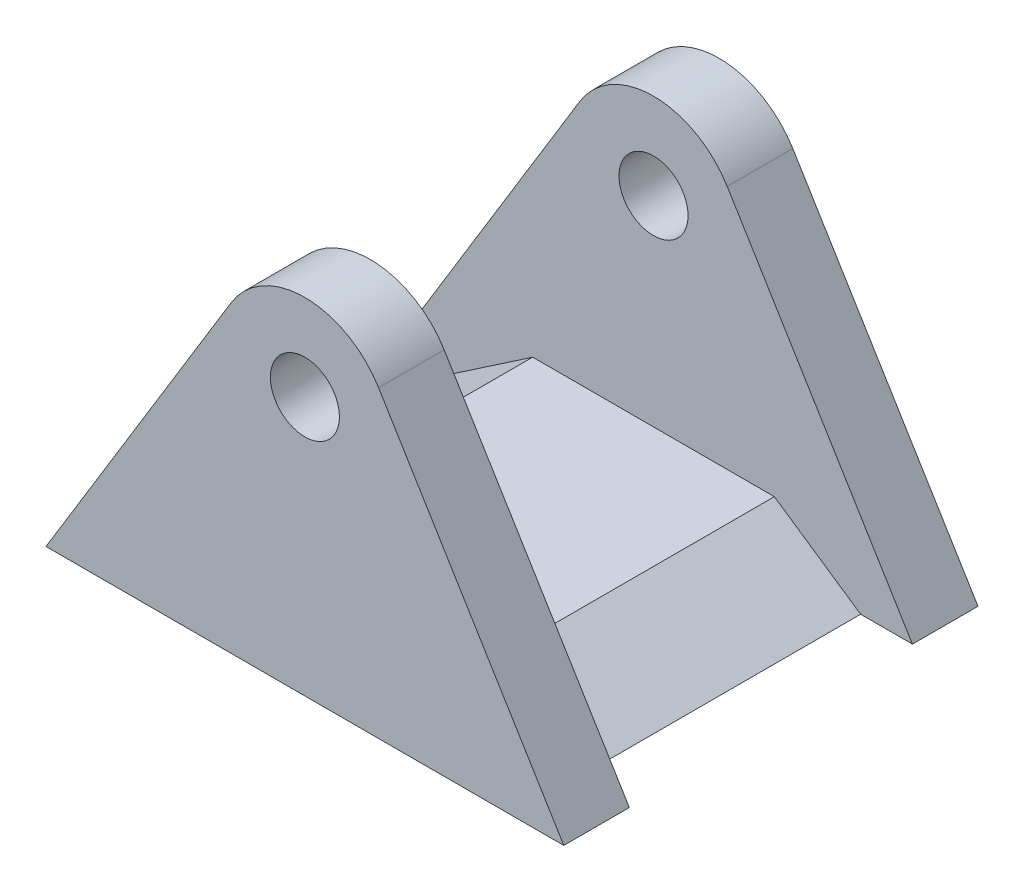
from build123d import *

# Parameters (mm, degrees)
EXTRUDE_1_DEPTH          = 4.1
EXTRUDE_1_DEPTH_BACK     = 4.1
SKETCH_2_R               = 1
EXTRUDE_2_DEPTH          = 1.9
EXTRUDE_3_DEPTH          = 2
EXTRUDE_3_DEPTH_BACK     = 2
CUT_EXTRUDE_1_DEPTH      = 2
CUT_EXTRUDE_1_DEPTH_BACK = 2
FILLET_1_R               = 0.1


with BuildPart() as part:
    # 草图1 → 凸台-拉伸1 (new, two sides: drawn at the far end of the back side and taken through both)
    with BuildSketch(Plane.XY.offset(-EXTRUDE_1_DEPTH_BACK)):
        Polygon((-6, 0), (6, 0), (3.5, 1.7), (-3.5, 1.7), align=None)
    extrude(amount=EXTRUDE_1_DEPTH + EXTRUDE_1_DEPTH_BACK)

    # 草图2 → 凸台-拉伸2 (add)
    with BuildSketch(Plane.XY.offset(4.1)):
        with BuildLine():
            Line((0, 0), (-7.5, 0))
            Line((-7.5, 0), (-2.134627344, 8.801294011))
            ThreePointArc((-2.134627344, 8.801294011), (0, 10), (2.134627344, 8.801294011))
            Line((2.134627344, 8.801294011), (7.5, 0))
            Line((7.5, 0), (0, 0))
        make_face()
        with Locations((0, 7.5)):
            Circle(SKETCH_2_R, mode=Mode.SUBTRACT)
    extrude_2 = extrude(amount=EXTRUDE_2_DEPTH)

    # 镜向1: 凸台-拉伸2 across plane
    add(extrude_2.mirror(Plane.XY))

    # 草图3 → 凸台-拉伸3 (add, two sides: drawn at the far end of the back side and taken through both)
    with BuildSketch(Plane.XY.offset(-EXTRUDE_3_DEPTH_BACK)):
        with BuildLine():
            Line((1.5, 0), (-1.5, 0))
            Line((-1.5, 0), (-1.5, -0.677124344))
            ThreePointArc((-1.5, -0.677124344), (-1.780042303, -1.088161527), (-1.95, -1.555590279))
            Line((-1.95, -1.555590279), (-1.95, -2.5))
            Line((-1.95, -2.5), (1.95, -2.5))
            Line((1.95, -2.5), (1.95, -1.555590279))
            ThreePointArc((1.95, -1.555590279), (1.780042303, -1.088161527), (1.5, -0.677124344))
            Line((1.5, -0.677124344), (1.5, 0))
        make_face()
    extrude(amount=EXTRUDE_3_DEPTH + EXTRUDE_3_DEPTH_BACK)

    # 草图4 → 切除-拉伸1 (cut, two sides: drawn at the far end of the back side and taken through both)
    with BuildSketch(Plane(origin=(0, 0, 0), x_dir=(0, 0, -1), z_dir=(1, 0, 0)).offset(-CUT_EXTRUDE_1_DEPTH_BACK)):
        with BuildLine():
            Line((-1.5, 0), (-1.5, -0.677124344))
            ThreePointArc((-1.5, -0.677124344), (-1.780042303, -1.088161527), (-1.95, -1.555590279))
            Line((-1.95, -1.555590279), (-1.95, -2.5))
            Line((-1.95, -2.5), (-2, -2.5))
            Line((-2, -2.5), (-2, 0))
            Line((-2, 0), (-1.5, 0))
        make_face()
        with BuildLine():
            Line((2, 0), (1.5, 0))
            Line((1.5, 0), (1.5, -0.677124344))
            ThreePointArc((1.5, -0.677124344), (1.780042303, -1.088161527), (1.95, -1.555590279))
            Line((1.95, -1.555590279), (1.95, -2.5))
            Line((1.95, -2.5), (2, -2.5))
            Line((2, -2.5), (2, 0))
        make_face()
    extrude(amount=CUT_EXTRUDE_1_DEPTH + CUT_EXTRUDE_1_DEPTH_BACK, mode=Mode.SUBTRACT)

    # 圆角1
    fillet_1_edges = [part.edges().sort_by_distance(p)[0] for p in [
        (0, -2.5, -1.95),
        (-1.95, -2.5, 0),
        (0, -2.5, 1.95),
        (1.95, -2.5, 0),
    ]]
    fillet(fillet_1_edges, radius=FILLET_1_R)


solid = part.part
